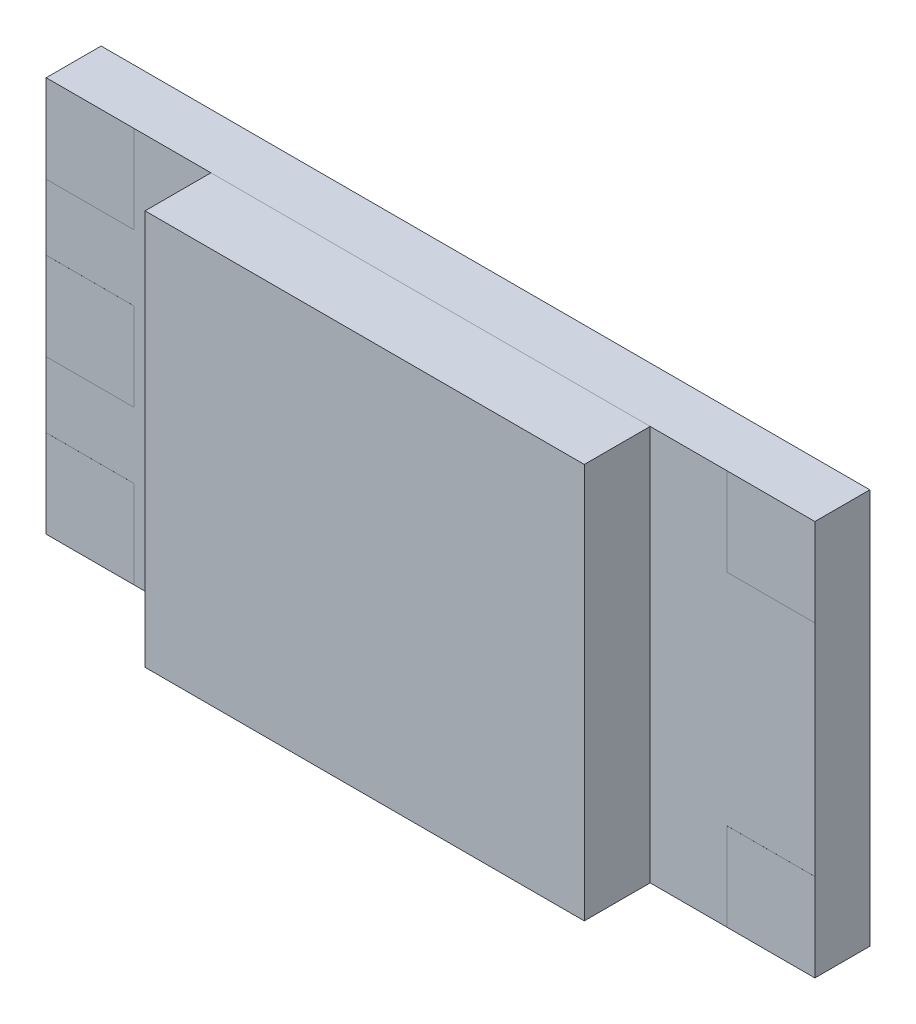
from build123d import *

# Parameters (mm, degrees)
SKETCH1_W             = 35
SKETCH1_H             = 18
BOSS_EXTRUDE1_DEPTH   = 2.5
SKETCH2_W             = 20
SKETCH2_H             = 18
BOSS_EXTRUDE2_DEPTH   = 3
SKETCH3_W             = 4
SKETCH3_H             = 4
BOSS_EXTRUDE3_DEPTH   = 0.001
BOSS_EXTRUDE3_2_DEPTH = 0.001
BOSS_EXTRUDE3_3_DEPTH = 0.001
BOSS_EXTRUDE3_4_DEPTH = 0.001
BOSS_EXTRUDE3_5_DEPTH = 0.001


with BuildPart() as part:
    # Sketch1 → Boss-Extrude1 (new body)
    with BuildSketch(Plane.XY):
        with Locations((17.5, 9)):
            Rectangle(SKETCH1_W, SKETCH1_H)
    extrude(amount=BOSS_EXTRUDE1_DEPTH)


with BuildPart() as body_2:
    # Sketch2 → Boss-Extrude2 (new body)
    with BuildSketch(Plane.XY.offset(2.5)):
        with Locations((17.5, 9)):
            Rectangle(SKETCH2_W, SKETCH2_H)
    extrude(amount=BOSS_EXTRUDE2_DEPTH)


with BuildPart() as body_3:
    # Sketch3 → Boss-Extrude3 (new body)
    with BuildSketch(Plane.XY.offset(2.5)):
        with Locations((2, 16)):
            Rectangle(SKETCH3_W, SKETCH3_H)
    extrude(amount=BOSS_EXTRUDE3_DEPTH)


with BuildPart() as body_4:
    # Sketch3 → Boss-Extrude3 2 (new body)
    with BuildSketch(Plane.XY.offset(2.5)):
        with Locations((2, 9)):
            Rectangle(SKETCH3_W, SKETCH3_H)
    extrude(amount=BOSS_EXTRUDE3_2_DEPTH)


with BuildPart() as body_5:
    # Sketch3 → Boss-Extrude3 3 (new body)
    with BuildSketch(Plane.XY.offset(2.5)):
        with Locations((2, 2)):
            Rectangle(SKETCH3_W, SKETCH3_H)
    extrude(amount=BOSS_EXTRUDE3_3_DEPTH)


with BuildPart() as body_6:
    # Sketch3 → Boss-Extrude3 4 (new body)
    with BuildSketch(Plane.XY.offset(2.5)):
        with Locations((33, 16)):
            Rectangle(SKETCH3_W, SKETCH3_H)
    extrude(amount=BOSS_EXTRUDE3_4_DEPTH)


with BuildPart() as body_7:
    # Sketch3 → Boss-Extrude3 5 (new body)
    with BuildSketch(Plane.XY.offset(2.5)):
        with Locations((33, 2)):
            Rectangle(SKETCH3_W, SKETCH3_H)
    extrude(amount=BOSS_EXTRUDE3_5_DEPTH)


solid = Compound([part.part, body_2.part, body_3.part, body_4.part, body_5.part, body_6.part, body_7.part])
